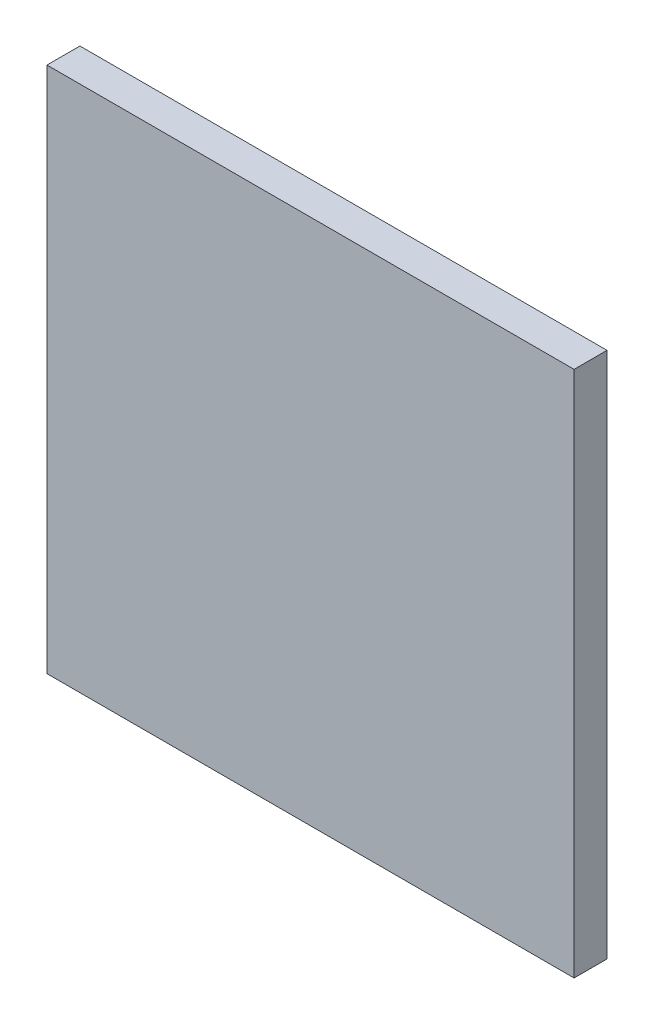
from build123d import *

# Parameters (mm, degrees)
SKETCH1_W           = 304.8
SKETCH1_H           = 304.8
BOSS_EXTRUDE1_DEPTH = 19.05
SKETCH2_W           = 254
SKETCH2_H           = 254
CUT_EXTRUDE1_DEPTH  = 18.796
SKETCH3_W           = 279.4
SKETCH3_H           = 279.4
CUT_EXTRUDE2_DEPTH  = 11.684


with BuildPart() as part:
    # Sketch1 → Boss-Extrude1 (new body)
    with BuildSketch(Plane.XY):
        Rectangle(SKETCH1_W, SKETCH1_H)
    extrude(amount=BOSS_EXTRUDE1_DEPTH)

    # Sketch2 → Cut-Extrude1 (cut)
    with BuildSketch(Plane(origin=(0, 0, 0), x_dir=(-1, 0, 0), z_dir=(0, 0, -1))):
        Rectangle(SKETCH2_W, SKETCH2_H)
    extrude(amount=-CUT_EXTRUDE1_DEPTH, mode=Mode.SUBTRACT)

    # Sketch3 → Cut-Extrude2 (cut)
    with BuildSketch(Plane(origin=(0, 0, 18.796), x_dir=(-1, 0, 0), z_dir=(0, 0, -1))):
        Rectangle(SKETCH3_W, SKETCH3_H)
    extrude(amount=CUT_EXTRUDE2_DEPTH, mode=Mode.SUBTRACT)


solid = part.part
